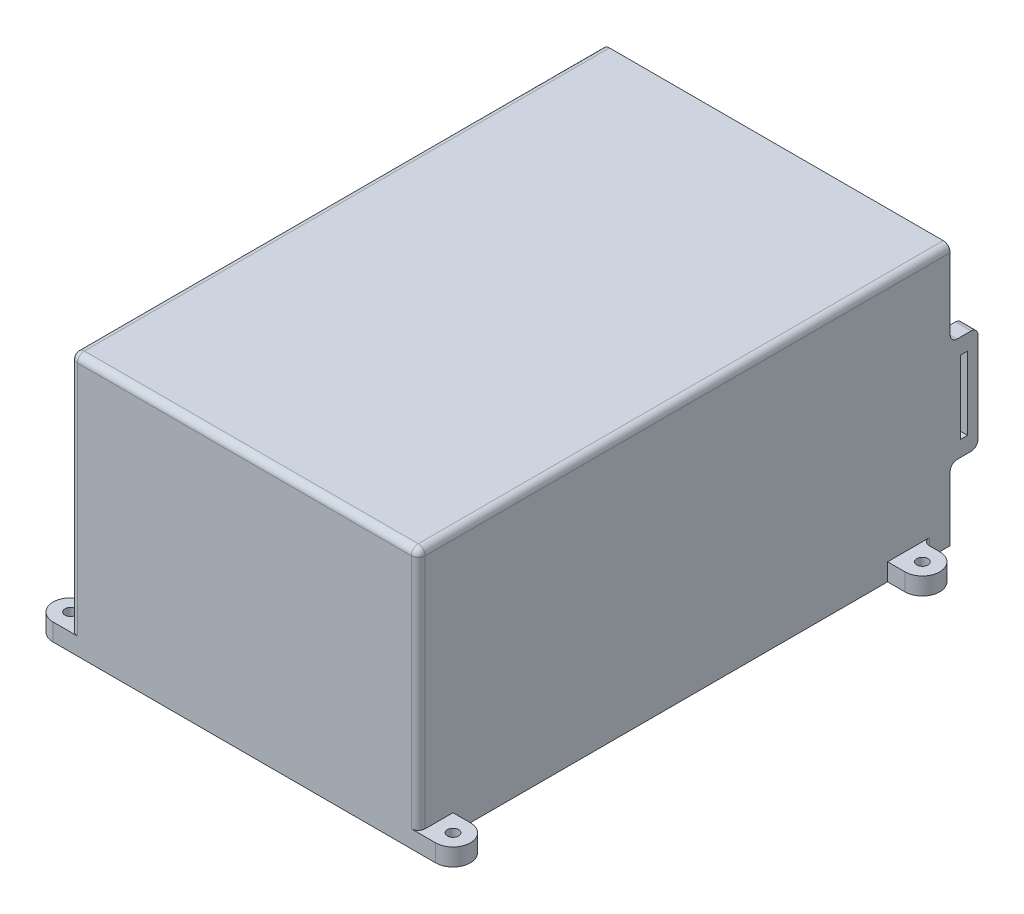
from build123d import *

# Parameters (mm, degrees)
SKETCH2_W                = 100
SKETCH2_H                = 145
BOSS_EXTRUDE1_DEPTH      = 75
SKETCH3_W                = 91
SKETCH3_H                = 140
CUT_EXTRUDE1_DEPTH       = 71
BOSS_EXTRUDE2_DEPTH      = 5
M3_CLEARANCE_HOLE2_D     = 3.2
M3_CLEARANCE_HOLE2_DEPTH = 12
M3_CLEARANCE_HOLE2_TIP   = 0.96137699
SKETCH11_W               = 8
SKETCH11_H               = 30
SKETCH11_W_2             = 2
SKETCH11_H_2             = 21
BOSS_EXTRUDE4_DEPTH      = 4
SKETCH13_W               = 91
SKETCH13_H               = 71
BOSS_EXTRUDE6_DEPTH      = 8
BOSS_EXTRUDE7_DEPTH      = 8
SKETCH12_W               = 8
SKETCH12_H               = 30
SKETCH12_W_2             = 2
SKETCH12_H_2             = 21
BOSS_EXTRUDE5_DEPTH      = 4.5
FILLET1_R                = 2


with BuildPart() as part:
    # Sketch2 → Boss-Extrude1 (new body)
    with BuildSketch(Plane(origin=(0, 0, 0), x_dir=(1, 0, 0), z_dir=(0, 1, 0))):
        Rectangle(SKETCH2_W, SKETCH2_H)
    extrude(amount=BOSS_EXTRUDE1_DEPTH)

    # Sketch3 → Cut-Extrude1 (cut)
    with BuildSketch(Plane.XZ):
        with Locations((0, -2.5)):
            Rectangle(SKETCH3_W, SKETCH3_H)
    extrude(amount=-CUT_EXTRUDE1_DEPTH, mode=Mode.SUBTRACT)

    # Sketch4 → Boss-Extrude2 (add)
    with BuildSketch(Plane.XZ):
        with BuildLine():
            Line((-50, 72.5), (-55, 72.5))
            ThreePointArc((-55, 72.5), (-60, 67.5), (-55, 62.5))
            Line((-55, 62.5), (-50, 62.5))
            Line((-50, 62.5), (-50, 72.5))
        make_face()
        with BuildLine():
            Line((50, 72.5), (55, 72.5))
            ThreePointArc((55, 72.5), (60, 67.5), (55, 62.5))
            Line((55, 62.5), (50, 62.5))
            Line((50, 62.5), (50, 72.5))
        make_face()
        with BuildLine():
            Line((-50, -72.5), (-55, -72.5))
            ThreePointArc((-55, -72.5), (-60, -67.5), (-55, -62.5))
            Line((-55, -62.5), (-50, -62.5))
            Line((-50, -62.5), (-50, -72.5))
        make_face()
        with BuildLine():
            Line((50, -72.5), (55, -72.5))
            ThreePointArc((55, -72.5), (60, -67.5), (55, -62.5))
            Line((55, -62.5), (50, -62.5))
            Line((50, -62.5), (50, -72.5))
        make_face()
    extrude(amount=-BOSS_EXTRUDE2_DEPTH)

    # M3 Clearance Hole2
    with Locations(Plane(origin=(0, 5, 0), x_dir=(1, 0, 0), z_dir=(0, 1, 0))):
        with Locations((-55, 67.5), (55, 67.5), (55, -67.5), (-55, -67.5)):
            Hole(M3_CLEARANCE_HOLE2_D / 2, depth=M3_CLEARANCE_HOLE2_DEPTH)
            with Locations((0, 0, -(M3_CLEARANCE_HOLE2_DEPTH + M3_CLEARANCE_HOLE2_TIP / 2))):  # 118° drill point
                Cone(0, M3_CLEARANCE_HOLE2_D / 2, M3_CLEARANCE_HOLE2_TIP, mode=Mode.SUBTRACT)

    # Sketch11 → Boss-Extrude4 (add, symmetric)
    with BuildSketch(Plane(origin=(0, 0, 12.5), x_dir=(-1, 0, 0), z_dir=(0, 0, -1))):
        with Locations((54, 35.5)):
            Rectangle(SKETCH11_W, SKETCH11_H)
        with Locations((54, 35.5)):
            Rectangle(SKETCH11_W_2, SKETCH11_H_2, mode=Mode.SUBTRACT)
    extrude(amount=BOSS_EXTRUDE4_DEPTH, both=True)

    # Sketch13 → Boss-Extrude6 (add)
    with BuildSketch(Plane(origin=(0, 0, 67.5), x_dir=(-1, 0, 0), z_dir=(0, 0, -1))):
        with Locations((0, 35.5)):
            Rectangle(SKETCH13_W, SKETCH13_H)
    extrude(amount=BOSS_EXTRUDE6_DEPTH)

    # Sketch15 → Boss-Extrude7 (add)
    with BuildSketch(Plane(origin=(0, 0, -72.5), x_dir=(-1, 0, 0), z_dir=(0, 0, -1))):
        Polygon((-50, 5), (-50, 0), (-45.5, 0), (-45.5, 71), (45.5, 71), (45.5, 0), (50, 0), (50, 5), (50, 75), (-50, 75), align=None)
    extrude(amount=BOSS_EXTRUDE7_DEPTH)

    # Sketch12 → Boss-Extrude5 (add)
    with BuildSketch(Plane(origin=(50, 0, 0), x_dir=(0, 0, -1), z_dir=(1, 0, 0))):
        with Locations((84.5, 35.5)):
            Rectangle(SKETCH12_W, SKETCH12_H)
        with Locations((84.5, 35.5)):
            Rectangle(SKETCH12_W_2, SKETCH12_H_2, mode=Mode.SUBTRACT)
    extrude(amount=-BOSS_EXTRUDE5_DEPTH)

    # Fillet1
    fillet1_edges = [part.edges().sort_by_distance(p)[0] for p in [
        (-50, 50.5, 12.5),
        (-50, 20.5, 12.5),
        (-58, 20.5, 12.5),
        (-58, 50.5, 12.5),
        (-50, 75, -4),
        (-50, 2.5, -72.5),
        (50, 2.5, -72.5),
        (0, 75, 72.5),
        (47.75, 20.5, -88.5),
        (47.75, 50.5, -88.5),
        (47.75, 50.5, -80.5),
        (47.75, 20.5, -80.5),
        (50, 75, -4),
        (50, 40, 72.5),
        (-50, 40, 72.5),
    ]]
    fillet(fillet1_edges, radius=FILLET1_R)


solid = part.part
